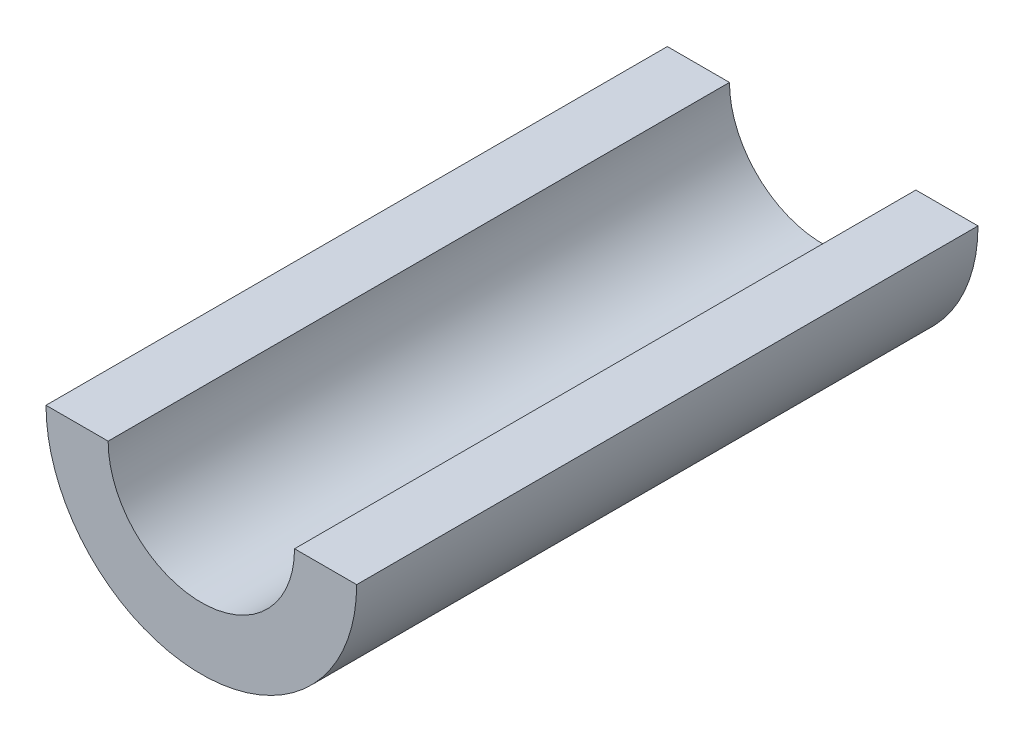
from build123d import *

# Parameters (mm, degrees)
SALIENTE_EXTRUIR1_DEPTH = 40


with BuildPart() as part:
    # Croquis1 → Saliente-Extruir1 (new body)
    with BuildSketch(Plane.XY):
        with BuildLine():
            Line((-10, 0), (-6, 0))
            ThreePointArc((-6, 0), (0, -6), (6, 0))
            Line((6, 0), (10, 0))
            ThreePointArc((10, 0), (0, -10), (-10, 0))
        make_face()
    extrude(amount=SALIENTE_EXTRUIR1_DEPTH)


solid = part.part
